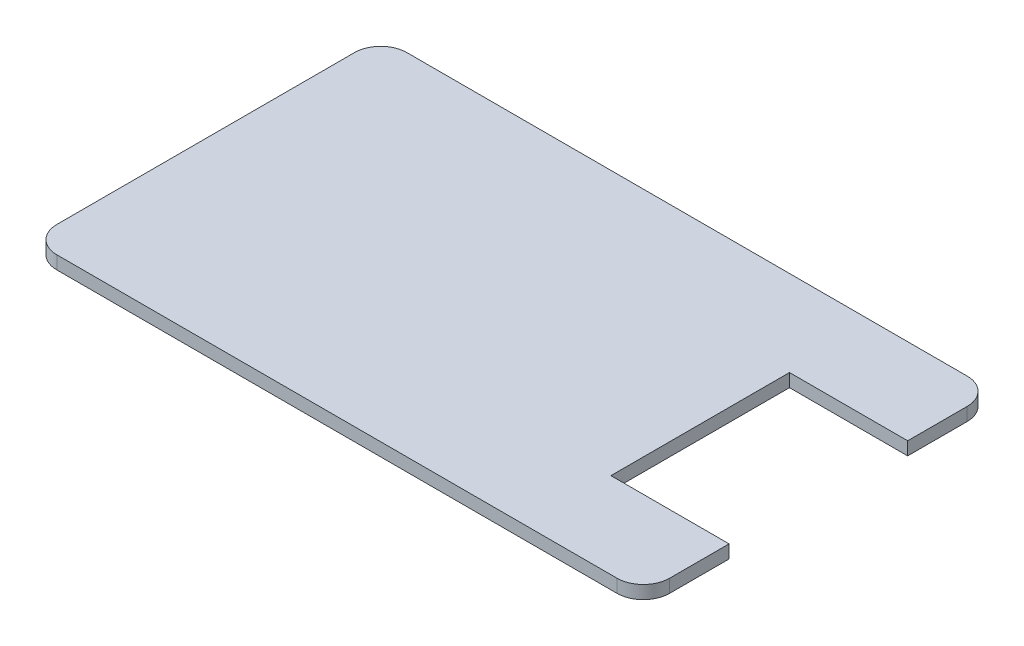
from build123d import *

# Parameters (mm, degrees)
SKETCH_1_W          = 70
SKETCH_1_H          = 40
EXTRUDE_1_DEPTH     = 1.5
FILLET_1_R          = 3
SKETCH_2_W          = 13.5
SKETCH_2_H          = 20.4
CUT_EXTRUDE_1_DEPTH = 41.339186903


with BuildPart() as part:
    # Эскиз1 → Бобышка-Вытянуть1 (new body)
    with BuildSketch(Plane(origin=(0, 0, 0), x_dir=(1, 0, 0), z_dir=(0, 1, 0))):
        Rectangle(SKETCH_1_W, SKETCH_1_H)
    extrude(amount=EXTRUDE_1_DEPTH)

    # Скругление1
    fillet_1_edges = [part.edges().sort_by_distance(p)[0] for p in [
        (-35, 0.75, -20),
        (35, 0.75, -20),
        (35, 0.75, 20),
        (-35, 0.75, 20),
    ]]
    fillet(fillet_1_edges, radius=FILLET_1_R)

    # Эскиз2 → Вырез-Вытянуть1 (cut, through all)
    with BuildSketch(Plane(origin=(0, 1.5, 0), x_dir=(1, 0, 0), z_dir=(0, 1, 0))):
        with Locations((28.25, 0)):
            Rectangle(SKETCH_2_W, SKETCH_2_H)
    extrude(amount=-CUT_EXTRUDE_1_DEPTH, mode=Mode.SUBTRACT)


solid = part.part
